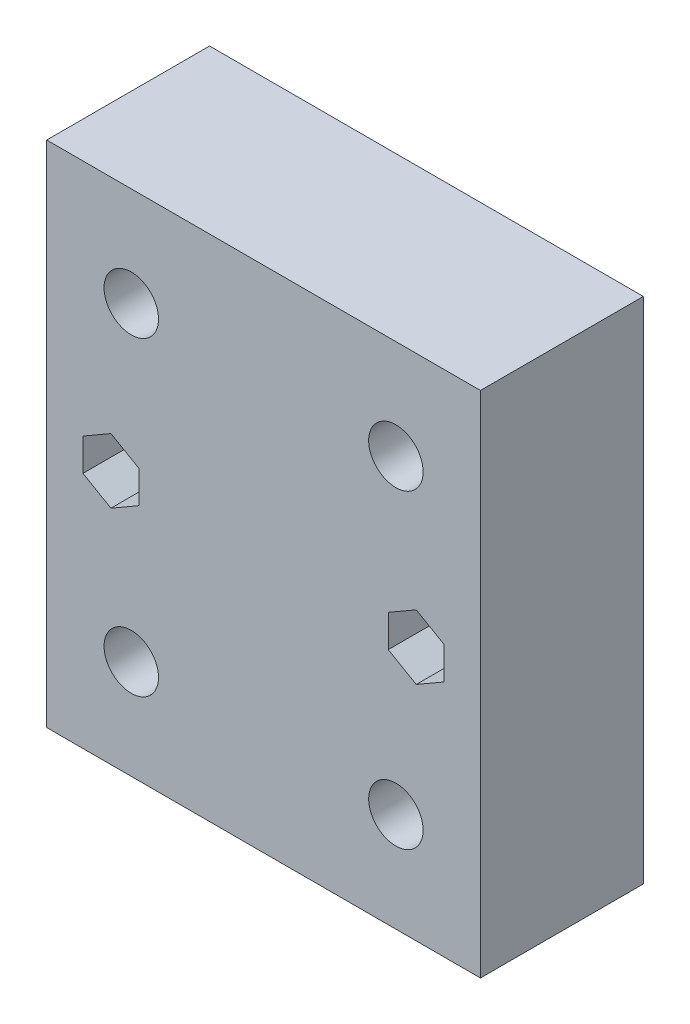
from build123d import *

# Parameters (mm, degrees)
SKETCH1_W           = 42.62295082
SKETCH1_H           = 50
SKETCH1_R           = 2.677018134
BOSS_EXTRUDE1_DEPTH = 16
SKETCH2_R           = 11
CUT_EXTRUDE2_DEPTH  = 11
SKETCH3_R           = 1.75
CUT_EXTRUDE3_DEPTH  = 10
SKETCH6_W           = 9.034037672
SKETCH6_H           = 2.387531408
CUT_EXTRUDE5_DEPTH  = 20
CUT_EXTRUDE6_START  = -5
CUT_EXTRUDE6_DEPTH  = 32.540101042


with BuildPart() as part:
    # Sketch1 → Boss-Extrude1 (new body)
    with BuildSketch(Plane.XY):
        Rectangle(SKETCH1_W, SKETCH1_H)
        with Locations((-13, -15.25)):
            Circle(SKETCH1_R, mode=Mode.SUBTRACT)
        with Locations(Location((13, -15.25, 0), (0, 0, 180))):
            Circle(SKETCH1_R, mode=Mode.SUBTRACT)
        with Locations((13, 15.25)):
            Circle(SKETCH1_R, mode=Mode.SUBTRACT)
        with Locations(Location((-13, 15.25, 0), (0, 0, 180))):
            Circle(SKETCH1_R, mode=Mode.SUBTRACT)
    extrude(amount=BOSS_EXTRUDE1_DEPTH)

    # Sketch2 → Cut-Extrude2 (cut)
    with BuildSketch(Plane.XY):
        Circle(SKETCH2_R)
    extrude(amount=CUT_EXTRUDE2_DEPTH, mode=Mode.SUBTRACT)

    # Sketch3 → Cut-Extrude3 (cut)
    with BuildSketch(Plane(origin=(0, 0, 0), x_dir=(-1, 0, 0), z_dir=(0, 0, -1))):
        with Locations((-15, 0)):
            Circle(SKETCH3_R)
        with Locations(Location((15, 0, 0), (0, 0, 180))):
            Circle(SKETCH3_R)
    extrude(amount=-CUT_EXTRUDE3_DEPTH, mode=Mode.SUBTRACT)

    # Sketch6 → Cut-Extrude5 (cut)
    with BuildSketch(Plane.XZ.offset(25)):
        with Locations((0, 12.193765704)):
            Rectangle(SKETCH6_W, SKETCH6_H)
    extrude(amount=-CUT_EXTRUDE5_DEPTH, mode=Mode.SUBTRACT)

    # Sketch9 → Cut-Extrude6 (cut, through all)
    with BuildSketch(Plane(origin=(0, 0, 0), x_dir=(-1, 0, 0), z_dir=(0, 0, -1)).offset(CUT_EXTRUDE6_START)):
        Polygon((-15, 3.175426481), (-17.75, 1.58771324), (-17.75, -1.58771324), (-15, -3.175426481), (-12.25, -1.58771324), (-12.25, 1.58771324), align=None)
        Polygon((12.25, 1.58771324), (15, 3.175426481), (17.75, 1.58771324), (17.75, -1.58771324), (15, -3.175426481), (12.25, -1.58771324), align=None)
    extrude(amount=-CUT_EXTRUDE6_DEPTH, mode=Mode.SUBTRACT)


solid = part.part
